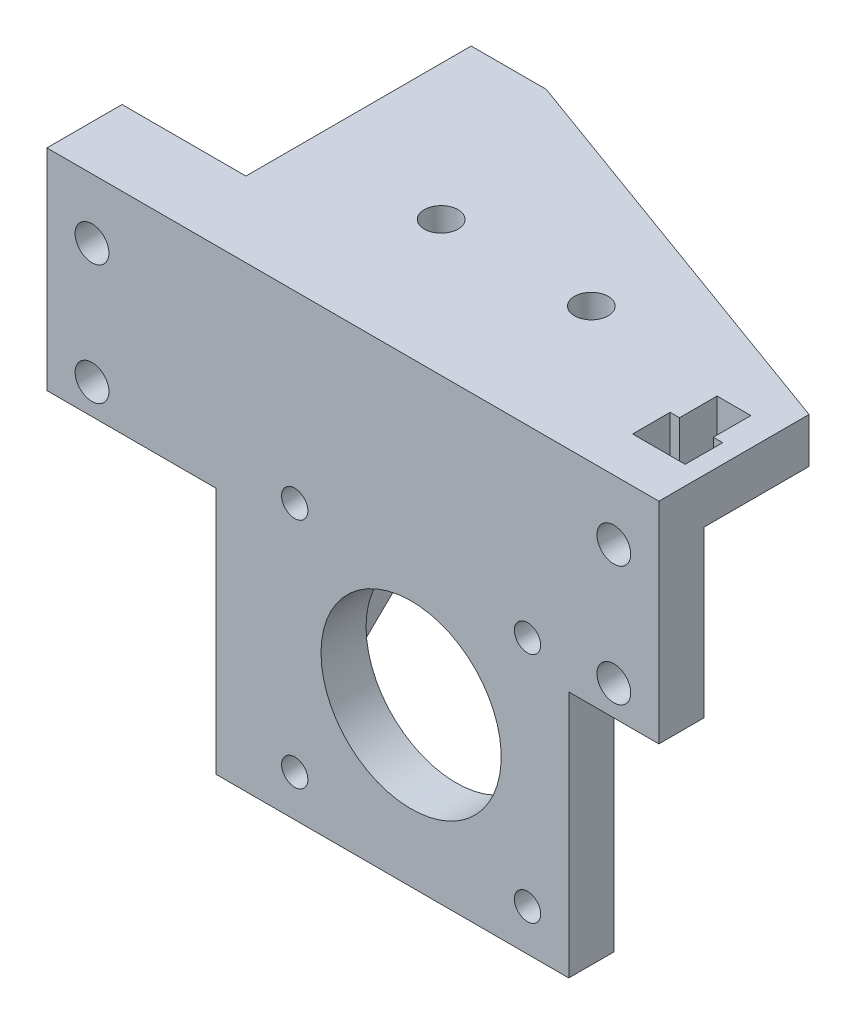
from build123d import *

# Parameters (mm, degrees)
BOSS_EXTRUDE1_DEPTH = 28
SKETCH3_W           = 43
SKETCH3_H           = 6
BOSS_EXTRUDE2_DEPTH = 61
SKETCH4_R           = 12
SKETCH4_R_2         = 1.75
CUT_EXTRUDE1_DEPTH  = 72.091490349
BOSS_EXTRUDE3_DEPTH = 12
BOSS_EXTRUDE4_DEPTH = 12
SKETCH5_R           = 2.25
CUT_EXTRUDE2_DEPTH  = 88.281154896
SKETCH8_W           = 55
SKETCH8_H           = 34
BOSS_EXTRUDE5_DEPTH = 6
CUT_EXTRUDE3_DEPTH  = 91.277350426
BOSS_EXTRUDE6_DEPTH = 4
SKETCH11_R          = 2.25
CUT_EXTRUDE4_DEPTH  = 71.809603868
CUT_EXTRUDE5_REACH  = 92.277
SKETCH12_R          = 2.25
CUT_EXTRUDE6_DEPTH  = 91.277350426
SKETCH14_W          = 8
SKETCH14_H          = 28
CUT_EXTRUDE7_DEPTH  = 93.90452088


with BuildPart() as part:
    # Sketch2 → Boss-Extrude1 (new body)
    with BuildSketch(Plane(origin=(0, 0, 0), x_dir=(1, 0, 0), z_dir=(0, 1, 0))):
        Polygon((-16.5, 0), (0, 0), (0, 30), (10, 30), (10, -10), (-16.5, -10), align=None)
    extrude(amount=BOSS_EXTRUDE1_DEPTH)

    # Sketch3 → Boss-Extrude2 (add)
    with BuildSketch(Plane(origin=(0, 28, 0), x_dir=(1, 0, 0), z_dir=(0, 1, 0))):
        with Locations((31.5, -7)):
            Rectangle(SKETCH3_W, SKETCH3_H)
    extrude(amount=-BOSS_EXTRUDE2_DEPTH)

    # Sketch4 → Cut-Extrude1 (cut, through all)
    with BuildSketch(Plane(origin=(0, 0, 4), x_dir=(-1, 0, 0), z_dir=(0, 0, -1))):
        with Locations((-32, -12)):
            Circle(SKETCH4_R)
        with Locations((-16.5, 3.5)):
            Circle(SKETCH4_R_2)
        with Locations((-16.5, -27.5)):
            Circle(SKETCH4_R_2)
        with Locations((-47.5, -27.5)):
            Circle(SKETCH4_R_2)
        with Locations((-47.5, 3.5)):
            Circle(SKETCH4_R_2)
    extrude(amount=-CUT_EXTRUDE1_DEPTH, mode=Mode.SUBTRACT)

    # Sketch6 → Boss-Extrude3 (add)
    with BuildSketch(Plane.ZY.offset(16.5)):
        with BuildLine():
            Line((10, 28), (10, 0))
            Line((10, 0), (18, 0))
            Line((18, 0), (18, 8))
            ThreePointArc((18, 8), (14, 12), (18, 16))
            Line((18, 16), (18, 28))
            Line((18, 28), (10, 28))
        make_face()
    extrude(amount=-BOSS_EXTRUDE3_DEPTH)

    # Sketch7 → Boss-Extrude4 (add)
    with BuildSketch(Plane(origin=(53, 0, 0), x_dir=(0, 0, -1), z_dir=(1, 0, 0))):
        with BuildLine():
            Line((-18, 8), (-18, 0))
            Line((-18, 0), (-4, 0))
            Line((-4, 0), (-4, 28))
            Line((-4, 28), (-18, 28))
            Line((-18, 28), (-18, 16))
            ThreePointArc((-18, 16), (-14, 12), (-18, 8))
        make_face()
    extrude(amount=BOSS_EXTRUDE4_DEPTH)

    # Sketch5 → Cut-Extrude2 (cut, through all)
    with BuildSketch(Plane.XY.offset(18)):
        with Locations((-10.5, 20)):
            Circle(SKETCH5_R)
        with Locations((-10.5, 4)):
            Circle(SKETCH5_R)
        with Locations(Location((59, 4, 0), (0, 0, 180))):
            Circle(SKETCH5_R)
        with Locations(Location((59, 20, 0), (0, 0, 180))):
            Circle(SKETCH5_R)
    extrude(amount=-CUT_EXTRUDE2_DEPTH, mode=Mode.SUBTRACT)

    # Sketch8 → Boss-Extrude5 (add)
    with BuildSketch(Plane(origin=(0, 28, 0), x_dir=(1, 0, 0), z_dir=(0, 1, 0))):
        with Locations((37.5, 13)):
            Rectangle(SKETCH8_W, SKETCH8_H)
    extrude(amount=-BOSS_EXTRUDE5_DEPTH)

    # Sketch9 → Cut-Extrude3 (cut, through all)
    with BuildSketch(Plane.XZ.offset(-22)):
        Polygon((55.5, 4), (62.5, 4), (62.5, -1), (61.25, -1), (61.25, -6), (56.75, -6), (56.75, -1), (55.5, -1), align=None)
    extrude(amount=-CUT_EXTRUDE3_DEPTH, mode=Mode.SUBTRACT)

    # Sketch10 → Boss-Extrude6 (add)
    with BuildSketch(Plane.ZY.offset(-10)):
        Polygon((-30, 0), (4, -33), (10, -33), (10, -24.264705882), (10, 0), (-15, 0), align=None)
    extrude(amount=BOSS_EXTRUDE6_DEPTH)

    # Sketch11 → Cut-Extrude4 (cut, through all)
    with BuildSketch(Plane(origin=(10, 0, 0), x_dir=(0, 0, -1), z_dir=(1, 0, 0))):
        with Locations((24, 17.5)):
            Circle(SKETCH11_R)
    extrude(amount=-CUT_EXTRUDE4_DEPTH, mode=Mode.SUBTRACT)

    # Sketch12 → Cut-Extrude5 (cut, up to next)
    with BuildSketch(Plane.XZ.offset(-22), mode=Mode.PRIVATE) as cut_extrude5_sk1:
        with Locations(Location((18, -8, 0), (0, 0, 270))):
            Circle(SKETCH12_R)
    cut_extrude5_tool1 = extrude(cut_extrude5_sk1.sketch, amount=-CUT_EXTRUDE5_REACH, mode=Mode.PRIVATE) & part.part
    # Sketch12 → Cut-Extrude5 (cut, up to next)
    with BuildSketch(Plane.XZ.offset(-22), mode=Mode.PRIVATE) as cut_extrude5_sk2:
        with Locations(Location((38, -8, 0), (0, 0, 270))):
            Circle(SKETCH12_R)
    cut_extrude5_tool2 = extrude(cut_extrude5_sk2.sketch, amount=-CUT_EXTRUDE5_REACH, mode=Mode.PRIVATE) & part.part
    add(cut_extrude5_tool1.solids().sort_by_distance((18, 22, -8))[0], mode=Mode.SUBTRACT)
    add(cut_extrude5_tool2.solids().sort_by_distance((38, 22, -8))[0], mode=Mode.SUBTRACT)

    # Sketch13 → Cut-Extrude6 (cut, through all)
    with BuildSketch(Plane.XZ.offset(-22)):
        Polygon((10, -30), (65, -10), (65, -30), align=None)
    extrude(amount=-CUT_EXTRUDE6_DEPTH, mode=Mode.SUBTRACT)

    # Sketch14 → Cut-Extrude7 (cut, through all)
    with BuildSketch(Plane.ZY.offset(16.5)):
        with Locations((14, 14)):
            Rectangle(SKETCH14_W, SKETCH14_H)
    extrude(amount=-CUT_EXTRUDE7_DEPTH, mode=Mode.SUBTRACT)


solid = part.part
